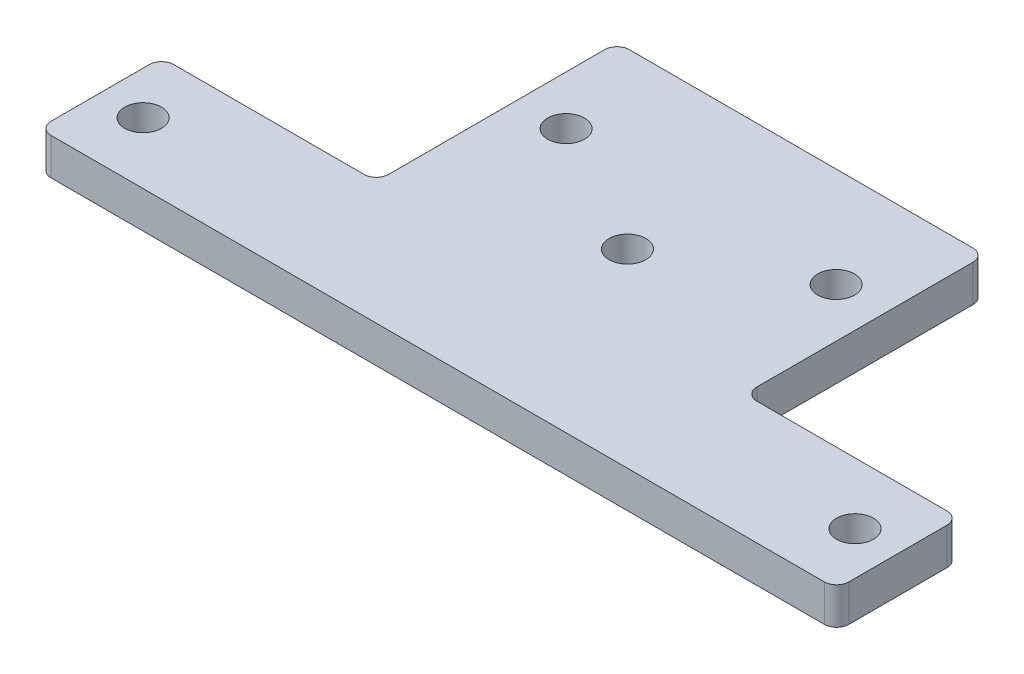
from build123d import *

# Parameters (mm, degrees)
CROQUIS1_R              = 1.5
SALIENTE_EXTRUIR1_DEPTH = 3
REDONDEO1_R             = 1


with BuildPart() as part:
    # Croquis1 → Saliente-Extruir1 (new body)
    with BuildSketch(Plane(origin=(0, 0, 0), x_dir=(1, 0, 0), z_dir=(0, 1, 0))):
        Polygon((32.802827881, -15.07231132), (32.802827881, -5.07231132), (15.302827881, -5.07231132), (15.302827881, 14.537092733), (-14.697172119, 14.537092733), (-14.697172119, -5.07231132), (-32.197172119, -5.07231132), (-32.197172119, -15.07231132), align=None)
        with Locations(Location((29.302827881, -10.07231132, 0), (0, 0, 270))):
            Circle(CROQUIS1_R, mode=Mode.SUBTRACT)
        with Locations(Location((-28.697172119, -10.07231132, 0), (0, 0, 90))):
            Circle(CROQUIS1_R, mode=Mode.SUBTRACT)
        with Locations(Location((-10.697172119, 6.389486457, 0), (0, 0, 270))):
            Circle(CROQUIS1_R, mode=Mode.SUBTRACT)
        with Locations(Location((11.302827881, 6.389486457, 0), (0, 0, 90))):
            Circle(CROQUIS1_R, mode=Mode.SUBTRACT)
        with Locations(Location((0.302827881, 0.389486457, 0), (0, 0, 270))):
            Circle(CROQUIS1_R, mode=Mode.SUBTRACT)
    extrude(amount=SALIENTE_EXTRUIR1_DEPTH)

    # Redondeo1
    redondeo1_edges = [part.edges().sort_by_distance(p)[0] for p in [
        (-14.697172119, 1.5, 5.07231132),
        (-14.697172119, 1.5, -14.537092733),
        (15.302827881, 1.5, -14.537092733),
        (15.302827881, 1.5, 5.07231132),
        (32.802827881, 1.5, 5.07231132),
        (32.802827881, 1.5, 15.07231132),
        (-32.197172119, 1.5, 15.07231132),
        (-32.197172119, 1.5, 5.07231132),
    ]]
    fillet(redondeo1_edges, radius=REDONDEO1_R)


solid = part.part
